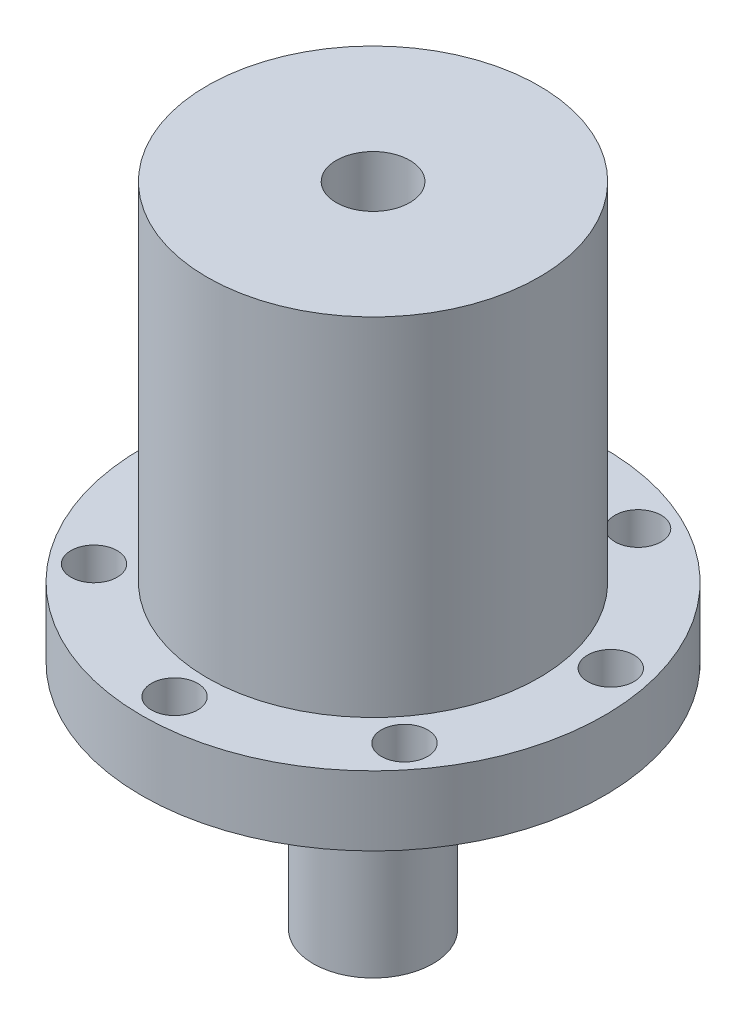
from build123d import *

# Parameters (mm, degrees)
BOSS_EXTRUDE1_DEPTH      = 15
BOSS_EXTRUDE1_DEPTH_BACK = 3
SKETCH1_R                = 7.175
SKETCH1_R_2              = 1.5875
SKETCH1_3_R              = 10
SKETCH1_3_R_2            = 7.175
BOSS_EXTRUDE2_DEPTH      = 3
SKETCH2_R                = 2.5
CUT_EXTRUDE1_DEPTH       = 15
CUT_EXTRUDE2_DEPTH       = 23.891046363
CUT_EXTRUDE2_DEPTH_BACK  = 23.891046363
SKETCH3_R                = 1
SKETCH4_R                = 2.5875
BOSS_EXTRUDE4_DEPTH      = 10
CUT_EXTRUDE3_DEPTH       = 15
CUT_EXTRUDE3_DEPTH_BACK  = 13
SKETCH1_5_R              = 1.5875


with BuildPart() as part:
    # Sketch1 → Boss-Extrude1 (new, two sides: drawn at the far end of the back side and taken through both)
    with BuildSketch(Plane(origin=(0, 0, 0), x_dir=(1, 0, 0), z_dir=(0, 1, 0)).offset(-BOSS_EXTRUDE1_DEPTH_BACK)):
        Circle(SKETCH1_R)
        Circle(SKETCH1_R_2, mode=Mode.SUBTRACT)
    extrude(amount=BOSS_EXTRUDE1_DEPTH + BOSS_EXTRUDE1_DEPTH_BACK)

    # Sketch2 → Cut-Extrude1 (cut)
    with BuildSketch(Plane(origin=(0, 0, 0), x_dir=(0, 0, -1), z_dir=(1, 0, 0))):
        with Locations((0, 6.702870317)):
            Circle(SKETCH2_R)
    extrude(amount=-CUT_EXTRUDE1_DEPTH, mode=Mode.SUBTRACT)



with BuildPart() as body_2:
    # Sketch1<3> → Boss-Extrude2 (new body)
    with BuildSketch(Plane(origin=(0, 0, 0), x_dir=(1, 0, 0), z_dir=(0, 1, 0))):
        Circle(SKETCH1_3_R)
        Circle(SKETCH1_3_R_2, mode=Mode.SUBTRACT)
    extrude(amount=-BOSS_EXTRUDE2_DEPTH)

    # Sketch3 → Cut-Extrude2 (cut, two sides: drawn at the far end of the back side and taken through both)
    with BuildSketch(Plane.XZ.offset(3).offset(-CUT_EXTRUDE2_DEPTH_BACK)):
        with Locations((0, 8.584939215)):
            Circle(SKETCH3_R)
        with Locations((6.711975754, 5.35262205)):
            Circle(SKETCH3_R)
        with Locations((8.369696865, -1.910328692)):
            Circle(SKETCH3_R)
        with Locations((3.724865527, -7.734762966)):
            Circle(SKETCH3_R)
        with Locations((-3.724865527, -7.734762966)):
            Circle(SKETCH3_R)
        with Locations((-8.369696865, -1.910328692)):
            Circle(SKETCH3_R)
        with Locations((-6.711975754, 5.35262205)):
            Circle(SKETCH3_R)
    extrude(amount=CUT_EXTRUDE2_DEPTH + CUT_EXTRUDE2_DEPTH_BACK, mode=Mode.SUBTRACT)


with BuildPart() as part_1:
    add(part.part)

    add(body_2.part)  # Boss-Extrude4 merges body 2
    # Sketch4 → Boss-Extrude4 (add)
    with BuildSketch(Plane.XZ.offset(3)):
        Circle(SKETCH4_R)
    extrude(amount=BOSS_EXTRUDE4_DEPTH)

    # Sketch1<5> → Cut-Extrude3 (cut, two sides: drawn at the far end of the back side and taken through both)
    with BuildSketch(Plane(origin=(0, 0, 0), x_dir=(1, 0, 0), z_dir=(0, 1, 0)).offset(-CUT_EXTRUDE3_DEPTH_BACK)):
        Circle(SKETCH1_5_R)
    extrude(amount=CUT_EXTRUDE3_DEPTH + CUT_EXTRUDE3_DEPTH_BACK, mode=Mode.SUBTRACT)


solid = part_1.part
